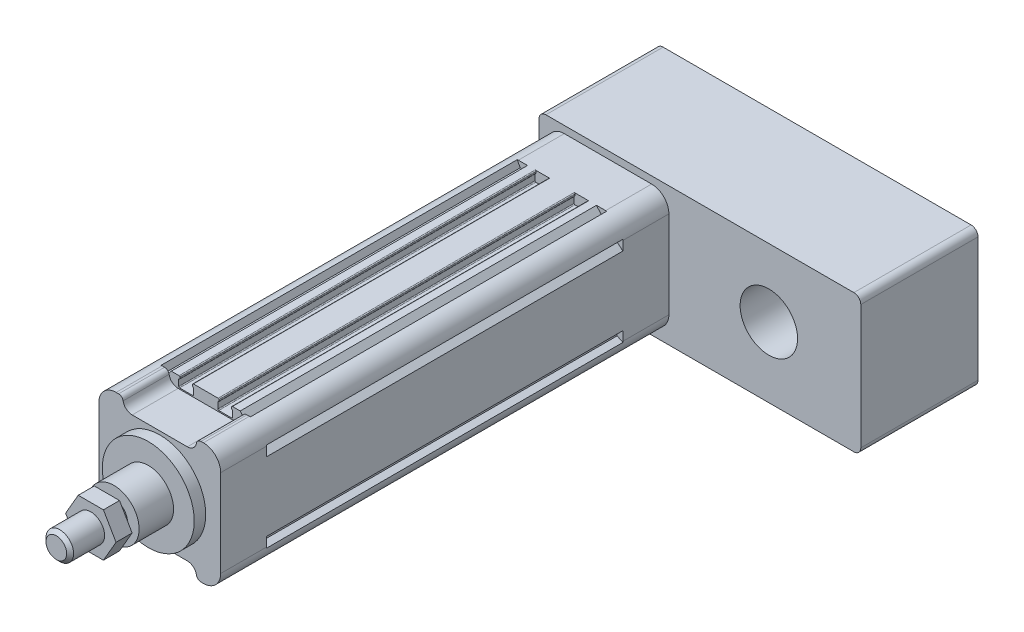
from build123d import *

# Parameters (mm, degrees)
SKETCH_1_R                  = 2.1
EXTRUDE_1_DEPTH             = 155
EXTRUDE_2_DEPTH             = 20
SKETCH_7_R                  = 20
EXTRUDE_3_DEPTH             = 5
SKETCH_9_R                  = 11
EXTRUDE_4_DEPTH             = 15
SKETCH_10_R                 = 6
EXTRUDE_5_DEPTH             = 25
EXTRUDE_START               = 20
EXTRUDE_6_DEPTH             = 20
EXTRUDE_7_DEPTH             = 51
SKETCH_13_R                 = 12.5
CUT_EXTRUDE_2_DEPTH         = 30
PATTERN_LINEAR_1_COUNT      = 2
PATTERN_LINEAR_1_PITCH      = 38
PATTERN_LINEAR_1_COUNT_DIR2 = 2
PATTERN_LINEAR_1_PITCH_DIR2 = 38
HOLE_WIZARD_M6_2_D          = 5
HOLE_WIZARD_M6_2_DEPTH      = 15
HOLE_WIZARD_M6_2_TIP        = 1.502151548
HOLE_WIZARD_M6_3_D          = 5
HOLE_WIZARD_M6_3_DEPTH      = 15
HOLE_WIZARD_M6_3_TIP        = 1.502151548
HOLE_WIZARD_M6_4_D          = 5
HOLE_WIZARD_M6_4_DEPTH      = 15
HOLE_WIZARD_M6_4_TIP        = 1.502151548
CHAMFER_1_SIZE              = 1.5
EXTRUDE_START_2             = 3
EXTRUDE_8_DEPTH             = 7


with BuildPart() as part:
    # 草图1 → 凸台-拉伸1 (new body)
    with BuildSketch(Plane.XY):
        with BuildLine():
            Line((-18.2, 24), (-19.443439638, 26.486879276))
            ThreePointArc((-19.443439638, 26.486879276), (-24.303300859, 24.303300859), (-26.486879276, 19.443439638))
            Line((-26.486879276, 19.443439638), (-24, 18.2))
            Line((-24, 18.2), (-24, 17.1))
            Line((-24, 17.1), (-26.5, 15))
            Line((-26.5, 15), (-26.5, -15))
            Line((-26.5, -15), (-24, -17.1))
            Line((-24, -17.1), (-24, -18.2))
            Line((-24, -18.2), (-26.486879276, -19.443439638))
            ThreePointArc((-26.486879276, -19.443439638), (-24.303300859, -24.303300859), (-19.443439638, -26.486879276))
            Line((-19.443439638, -26.486879276), (-18.2, -24))
            Line((-18.2, -24), (-17.1, -24))
            Line((-17.1, -24), (-15, -26.5))
            Line((-15, -26.5), (-11.65, -26.5))
            ThreePointArc((-11.65, -26.5), (-11.367157288, -26.382842712), (-11.25, -26.1))
            Line((-11.25, -26.1), (-11.25, -25.6))
            ThreePointArc((-11.25, -25.6), (-11.367157288, -25.317157288), (-11.65, -25.2))
            Line((-11.65, -25.2), (-11.75, -25.2))
            Line((-11.75, -25.2), (-11.75, -22.4))
            ThreePointArc((-11.75, -22.4), (-11.632842712, -22.117157288), (-11.35, -22))
            Line((-11.35, -22), (-5.65, -22))
            ThreePointArc((-5.65, -22), (-5.367157288, -22.117157288), (-5.25, -22.4))
            Line((-5.25, -22.4), (-5.25, -25.2))
            Line((-5.25, -25.2), (-5.35, -25.2))
            ThreePointArc((-5.35, -25.2), (-5.632842712, -25.317157288), (-5.75, -25.6))
            Line((-5.75, -25.6), (-5.75, -26.1))
            ThreePointArc((-5.75, -26.1), (-5.632842712, -26.382842712), (-5.35, -26.5))
            Line((-5.35, -26.5), (5.35, -26.5))
            ThreePointArc((5.35, -26.5), (5.632842712, -26.382842712), (5.75, -26.1))
            Line((5.75, -26.1), (5.75, -25.6))
            ThreePointArc((5.75, -25.6), (5.632842712, -25.317157288), (5.35, -25.2))
            Line((5.35, -25.2), (5.25, -25.2))
            Line((5.25, -25.2), (5.25, -22.4))
            ThreePointArc((5.25, -22.4), (5.367157288, -22.117157288), (5.65, -22))
            Line((5.65, -22), (11.35, -22))
            ThreePointArc((11.35, -22), (11.632842712, -22.117157288), (11.75, -22.4))
            Line((11.75, -22.4), (11.75, -25.2))
            Line((11.75, -25.2), (11.65, -25.2))
            ThreePointArc((11.65, -25.2), (11.367157288, -25.317157288), (11.25, -25.6))
            Line((11.25, -25.6), (11.25, -26.1))
            ThreePointArc((11.25, -26.1), (11.367157288, -26.382842712), (11.65, -26.5))
            Line((11.65, -26.5), (15, -26.5))
            Line((15, -26.5), (17.1, -24))
            Line((17.1, -24), (18.2, -24))
            Line((18.2, -24), (19.443439638, -26.486879276))
            ThreePointArc((19.443439638, -26.486879276), (24.303300859, -24.303300859), (26.486879276, -19.443439638))
            Line((26.486879276, -19.443439638), (24, -18.2))
            Line((24, -18.2), (24, -17.1))
            Line((24, -17.1), (26.5, -15))
            Line((26.5, -15), (26.5, 15))
            Line((26.5, 15), (24, 17.1))
            Line((24, 17.1), (24, 18.2))
            Line((24, 18.2), (26.486879276, 19.443439638))
            ThreePointArc((26.486879276, 19.443439638), (24.303300859, 24.303300859), (19.443439638, 26.486879276))
            Line((19.443439638, 26.486879276), (18.2, 24))
            Line((18.2, 24), (17.1, 24))
            Line((17.1, 24), (15, 26.5))
            Line((15, 26.5), (11.65, 26.5))
            ThreePointArc((11.65, 26.5), (11.367157288, 26.382842712), (11.25, 26.1))
            Line((11.25, 26.1), (11.25, 25.6))
            ThreePointArc((11.25, 25.6), (11.367157288, 25.317157288), (11.65, 25.2))
            Line((11.65, 25.2), (11.75, 25.2))
            Line((11.75, 25.2), (11.75, 22.4))
            ThreePointArc((11.75, 22.4), (11.632842712, 22.117157288), (11.35, 22))
            Line((11.35, 22), (5.65, 22))
            ThreePointArc((5.65, 22), (5.367157288, 22.117157288), (5.25, 22.4))
            Line((5.25, 22.4), (5.25, 25.2))
            Line((5.25, 25.2), (5.35, 25.2))
            ThreePointArc((5.35, 25.2), (5.632842712, 25.317157288), (5.75, 25.6))
            Line((5.75, 25.6), (5.75, 26.1))
            ThreePointArc((5.75, 26.1), (5.632842712, 26.382842712), (5.35, 26.5))
            Line((5.35, 26.5), (-5.35, 26.5))
            ThreePointArc((-5.35, 26.5), (-5.632842712, 26.382842712), (-5.75, 26.1))
            Line((-5.75, 26.1), (-5.75, 25.6))
            ThreePointArc((-5.75, 25.6), (-5.632842712, 25.317157288), (-5.35, 25.2))
            Line((-5.35, 25.2), (-5.25, 25.2))
            Line((-5.25, 25.2), (-5.25, 22.4))
            ThreePointArc((-5.25, 22.4), (-5.367157288, 22.117157288), (-5.65, 22))
            Line((-5.65, 22), (-11.35, 22))
            ThreePointArc((-11.35, 22), (-11.632842712, 22.117157288), (-11.75, 22.4))
            Line((-11.75, 22.4), (-11.75, 25.2))
            Line((-11.75, 25.2), (-11.65, 25.2))
            ThreePointArc((-11.65, 25.2), (-11.367157288, 25.317157288), (-11.25, 25.6))
            Line((-11.25, 25.6), (-11.25, 26.1))
            ThreePointArc((-11.25, 26.1), (-11.367157288, 26.382842712), (-11.65, 26.5))
            Line((-11.65, 26.5), (-15, 26.5))
            Line((-15, 26.5), (-17.1, 24))
            Line((-17.1, 24), (-18.2, 24))
        make_face()
        with Locations((19, 19)):
            Circle(SKETCH_1_R, mode=Mode.SUBTRACT)
        with Locations((19, -19)):
            Circle(SKETCH_1_R, mode=Mode.SUBTRACT)
        with Locations((-19, -19)):
            Circle(SKETCH_1_R, mode=Mode.SUBTRACT)
        with Locations((-19, 19)):
            Circle(SKETCH_1_R, mode=Mode.SUBTRACT)
        with BuildLine():
            Line((19.773719933, 3), (23.3, 3))
            Line((23.3, 3), (23.3, -3))
            Line((23.3, -3), (19.773719933, -3))
            ThreePointArc((19.773719933, -3), (0, -20), (-19.773719933, -3))
            Line((-19.773719933, -3), (-23.3, -3))
            Line((-23.3, -3), (-23.3, 3))
            Line((-23.3, 3), (-19.773719933, 3))
            ThreePointArc((-19.773719933, 3), (0, 20), (19.773719933, 3))
        make_face(mode=Mode.SUBTRACT)
    extrude(amount=EXTRUDE_1_DEPTH)

    # 草图6 → 凸台-拉伸2 (add)
    with BuildSketch(Plane.XY.offset(155)):
        with BuildLine():
            Line((-26.5, -19), (-26.5, 19))
            ThreePointArc((-26.5, 19), (-24.303300859, 24.303300859), (-19, 26.5))
            Line((-19, 26.5), (-17.916079783, 26.5))
            ThreePointArc((-17.916079783, 26.5), (-16.625085334, 26.027525232), (-15.944053189, 24.833333333))
            ThreePointArc((-15.944053189, 24.833333333), (-14.581988897, 22.444949537), (-12, 21.5))
            Line((-12, 21.5), (12, 21.5))
            ThreePointArc((12, 21.5), (14.581988897, 22.444949537), (15.944053189, 24.833333333))
            ThreePointArc((15.944053189, 24.833333333), (16.625085334, 26.027525232), (17.916079783, 26.5))
            Line((17.916079783, 26.5), (19, 26.5))
            ThreePointArc((19, 26.5), (24.303300859, 24.303300859), (26.5, 19))
            Line((26.5, 19), (26.5, -19))
            ThreePointArc((26.5, -19), (24.303300859, -24.303300859), (19, -26.5))
            Line((19, -26.5), (17.916079783, -26.5))
            ThreePointArc((17.916079783, -26.5), (16.625085334, -26.027525232), (15.944053189, -24.833333333))
            ThreePointArc((15.944053189, -24.833333333), (14.581988897, -22.444949537), (12, -21.5))
            Line((12, -21.5), (-12, -21.5))
            ThreePointArc((-12, -21.5), (-14.581988897, -22.444949537), (-15.944053189, -24.833333333))
            ThreePointArc((-15.944053189, -24.833333333), (-16.625085334, -26.027525232), (-17.916079783, -26.5))
            Line((-17.916079783, -26.5), (-19, -26.5))
            ThreePointArc((-19, -26.5), (-24.303300859, -24.303300859), (-26.5, -19))
        make_face()
    extrude(amount=EXTRUDE_2_DEPTH)

    # 草图7 → 凸台-拉伸3 (add)
    with BuildSketch(Plane.XY.offset(175)):
        Circle(SKETCH_7_R)
    extrude(amount=EXTRUDE_3_DEPTH)

    # 草图9 → 凸台-拉伸4 (add)
    with BuildSketch(Plane.XY.offset(180)):
        Circle(SKETCH_9_R)
    extrude(amount=EXTRUDE_4_DEPTH)

    # 草图10 → 凸台-拉伸5 (add)
    with BuildSketch(Plane.XY.offset(195)):
        Circle(SKETCH_10_R)
    extrude(amount=EXTRUDE_5_DEPTH)

    # 草图11 → 凸台-拉伸6 (add)
    with BuildSketch(Plane(origin=(0, 0, 0), x_dir=(-1, 0, 0), z_dir=(0, 0, -1)).offset(EXTRUDE_START)):
        with BuildLine():
            Line((-19, -26.5), (19, -26.5))
            ThreePointArc((19, -26.5), (24.303300859, -24.303300859), (26.5, -19))
            Line((26.5, -19), (26.5, 19))
            ThreePointArc((26.5, 19), (24.303300859, 24.303300859), (19, 26.5))
            Line((19, 26.5), (-19, 26.5))
            ThreePointArc((-19, 26.5), (-24.303300859, 24.303300859), (-26.5, 19))
            Line((-26.5, 19), (-26.5, -19))
            ThreePointArc((-26.5, -19), (-24.303300859, -24.303300859), (-19, -26.5))
        make_face()
    extrude(amount=-EXTRUDE_6_DEPTH)

    # 草图12 → 凸台-拉伸7 (add)
    with BuildSketch(Plane(origin=(0, 0, -20), x_dir=(-1, 0, 0), z_dir=(0, 0, -1))):
        with BuildLine():
            Line((-107, -30.404162038), (27, -30.404162038))
            ThreePointArc((27, -30.404162038), (29.121320344, -29.525482382), (30, -27.404162038))
            Line((30, -27.404162038), (30, 26.595837962))
            ThreePointArc((30, 26.595837962), (29.121320344, 28.717158305), (27, 29.595837962))
            Line((27, 29.595837962), (-107, 29.595837962))
            ThreePointArc((-107, 29.595837962), (-109.121320344, 28.717158305), (-110, 26.595837962))
            Line((-110, 26.595837962), (-110, -27.404162038))
            ThreePointArc((-110, -27.404162038), (-109.121320344, -29.525482382), (-107, -30.404162038))
        make_face()
    extrude(amount=EXTRUDE_7_DEPTH)

    # 草图13 → 切除-拉伸2 (cut)
    with BuildSketch(Plane.XY.offset(-20)):
        with Locations((70, 0)):
            Circle(SKETCH_13_R)
    extrude(amount=-CUT_EXTRUDE_2_DEPTH, mode=Mode.SUBTRACT)

    # 草图15 → M6 螺纹孔1 (revolve, cut)
    with BuildSketch(Plane(origin=(-19, -19, -71), x_dir=(0, 1, 0), z_dir=(1, 0, 0))):
        Polygon((0, 0), (0, 16.502151548), (2.5, 15), (2.5, 0), align=None)
    hole_wizard_m6_1 = revolve(axis=Axis((-19, -19, -77.35), (0, 0, 1)), mode=Mode.SUBTRACT)

    # 阵列(线性)1: Hole Wizard M6 _1 2 × 2
    with Locations(*[(j * PATTERN_LINEAR_1_PITCH_DIR2, i * PATTERN_LINEAR_1_PITCH, 0) for i in range(PATTERN_LINEAR_1_COUNT) for j in range(PATTERN_LINEAR_1_COUNT_DIR2) if (i, j) != (0, 0)]):
        add(hole_wizard_m6_1, mode=Mode.SUBTRACT)

    # M6 螺纹孔2
    with Locations(Plane(origin=(0, 0, -71), x_dir=(-1, 0, 0), z_dir=(0, 0, -1))):
        with Locations((-84, -19), (-84, 19)):
            Hole(HOLE_WIZARD_M6_2_D / 2, depth=HOLE_WIZARD_M6_2_DEPTH)
            with Locations((0, 0, -(HOLE_WIZARD_M6_2_DEPTH + HOLE_WIZARD_M6_2_TIP / 2))):  # 118° drill point
                Cone(0, HOLE_WIZARD_M6_2_D / 2, HOLE_WIZARD_M6_2_TIP, mode=Mode.SUBTRACT)

    # M6 螺纹孔3
    with Locations(Plane.ZY.offset(26.5)):
        with Locations((165, 11), (165, -11)):
            Hole(HOLE_WIZARD_M6_3_D / 2, depth=HOLE_WIZARD_M6_3_DEPTH)
            with Locations((0, 0, -(HOLE_WIZARD_M6_3_DEPTH + HOLE_WIZARD_M6_3_TIP / 2))):  # 118° drill point
                Cone(0, HOLE_WIZARD_M6_3_D / 2, HOLE_WIZARD_M6_3_TIP, mode=Mode.SUBTRACT)

    # M6 螺纹孔4
    with Locations(Plane.ZY.offset(26.5)):
        with Locations((-10, 11), (-10, -11)):
            Hole(HOLE_WIZARD_M6_4_D / 2, depth=HOLE_WIZARD_M6_4_DEPTH)
            with Locations((0, 0, -(HOLE_WIZARD_M6_4_DEPTH + HOLE_WIZARD_M6_4_TIP / 2))):  # 118° drill point
                Cone(0, HOLE_WIZARD_M6_4_D / 2, HOLE_WIZARD_M6_4_TIP, mode=Mode.SUBTRACT)

    # 倒角1
    chamfer_1_edges = [part.edges().sort_by_distance(p)[0] for p in [
        (-6, 0, 220),
    ]]
    chamfer(chamfer_1_edges, length=CHAMFER_1_SIZE)

    # 草图23 → 凸台-拉伸8 (add)
    with BuildSketch(Plane.XY.offset(195).offset(EXTRUDE_START_2)):
        Polygon((10.969655115, 0), (5.484827557, 9.5), (-5.484827557, 9.5), (-10.969655115, 0), (-5.484827557, -9.5), (5.484827557, -9.5), align=None)
    extrude(amount=EXTRUDE_8_DEPTH)


solid = part.part
